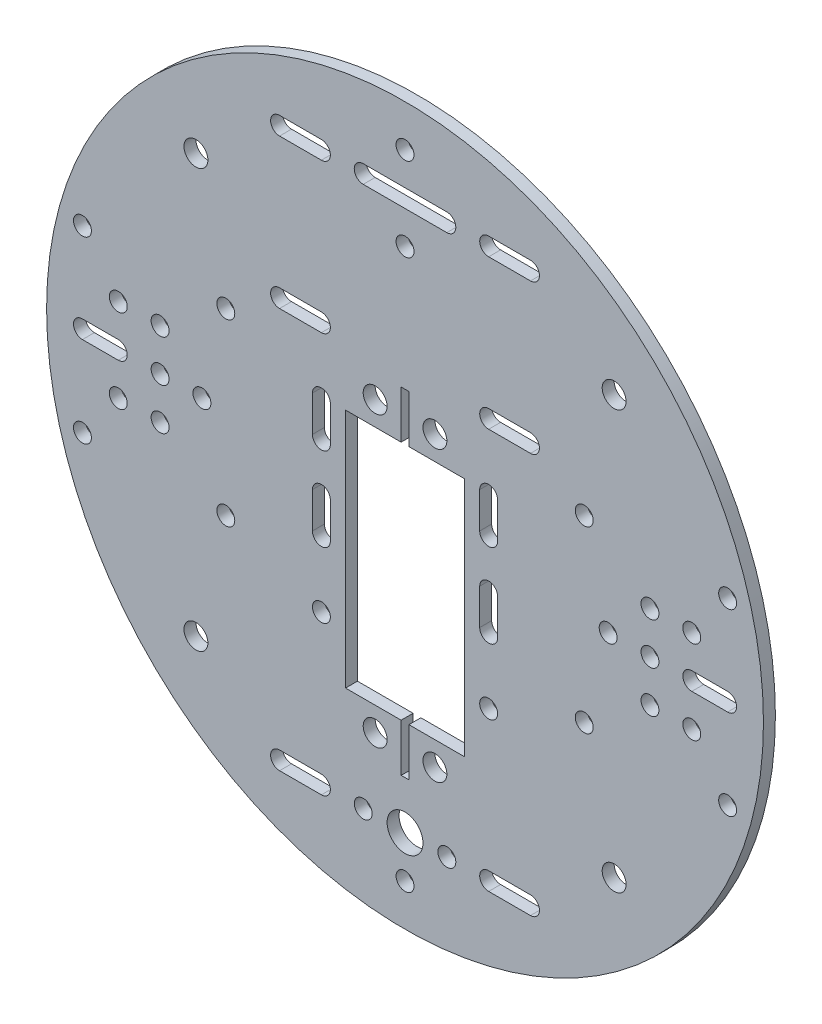
from build123d import *

# Parameters (mm, degrees)
SKETCH_2_R      = 60
SKETCH_2_R_2    = 2
SKETCH_2_R_3    = 1.5
SKETCH_2_R_4    = 3
EXTRUDE_1_DEPTH = 2


with BuildPart() as part:
    # 草图2 → 凸台-拉伸1 (new body)
    with BuildSketch(Plane.XY):
        with Locations((1.687240704, 17.758147453)):
            Circle(SKETCH_2_R)
        with Locations((-3.312759296, 32.050802338)):
            Circle(SKETCH_2_R_2, mode=Mode.SUBTRACT)
        with Locations((6.687240704, -16.249197662)):
            Circle(SKETCH_2_R_2, mode=Mode.SUBTRACT)
        with Locations((-3.312759296, -16.249197662)):
            Circle(SKETCH_2_R_2, mode=Mode.SUBTRACT)
        with Locations((-28.312759296, 32.758147453)):
            Circle(SKETCH_2_R_3, mode=Mode.SUBTRACT)
        with Locations((-52.312759296, 32.758147453)):
            Circle(SKETCH_2_R_3, mode=Mode.SUBTRACT)
        with Locations((-28.312759296, 2.758147453)):
            Circle(SKETCH_2_R_3, mode=Mode.SUBTRACT)
        with Locations((-52.312759296, 2.758147453)):
            Circle(SKETCH_2_R_3, mode=Mode.SUBTRACT)
        with Locations((31.687240704, 32.758147453)):
            Circle(SKETCH_2_R_3, mode=Mode.SUBTRACT)
        with Locations((55.687240704, 32.758147453)):
            Circle(SKETCH_2_R_3, mode=Mode.SUBTRACT)
        with Locations((31.687240704, 2.758147453)):
            Circle(SKETCH_2_R_3, mode=Mode.SUBTRACT)
        with Locations((55.687240704, 2.758147453)):
            Circle(SKETCH_2_R_3, mode=Mode.SUBTRACT)
        with Locations((36.689026372, -17.243638216)):
            Circle(SKETCH_2_R_2, mode=Mode.SUBTRACT)
        with Locations((-33.314544965, -17.243638216)):
            Circle(SKETCH_2_R_2, mode=Mode.SUBTRACT)
        with Locations((-33.314544965, 52.759933122)):
            Circle(SKETCH_2_R_2, mode=Mode.SUBTRACT)
        with Locations((36.689026372, 52.759933122)):
            Circle(SKETCH_2_R_2, mode=Mode.SUBTRACT)
        with Locations((-12.312759296, -3.241852547)):
            Circle(SKETCH_2_R_3, mode=Mode.SUBTRACT)
        with Locations((15.687240704, -3.241852547)):
            Circle(SKETCH_2_R_3, mode=Mode.SUBTRACT)
        with Locations((42.687240704, 24.758147453)):
            Circle(SKETCH_2_R_3, mode=Mode.SUBTRACT)
        with Locations((42.687240704, 10.758147453)):
            Circle(SKETCH_2_R_3, mode=Mode.SUBTRACT)
        with Locations((35.687240704, 17.758147453)):
            Circle(SKETCH_2_R_3, mode=Mode.SUBTRACT)
        with Locations((-39.312759296, 24.758147453)):
            Circle(SKETCH_2_R_3, mode=Mode.SUBTRACT)
        with Locations((-39.312759296, 10.758147453)):
            Circle(SKETCH_2_R_3, mode=Mode.SUBTRACT)
        with Locations((-32.312759296, 17.758147453)):
            Circle(SKETCH_2_R_3, mode=Mode.SUBTRACT)
        with Locations((1.687240704, -35.241852547)):
            Circle(SKETCH_2_R_3, mode=Mode.SUBTRACT)
        with Locations((6.687240704, 32.050802338)):
            Circle(SKETCH_2_R_2, mode=Mode.SUBTRACT)
        with Locations((1.687240704, -28.241852547)):
            Circle(SKETCH_2_R_4, mode=Mode.SUBTRACT)
        with Locations((8.687240704, -28.241852547)):
            Circle(SKETCH_2_R_3, mode=Mode.SUBTRACT)
        with Locations((-5.312759296, -28.241852547)):
            Circle(SKETCH_2_R_3, mode=Mode.SUBTRACT)
        with Locations((49.687240704, 10.758147453)):
            Circle(SKETCH_2_R_3, mode=Mode.SUBTRACT)
        with Locations((42.687240704, 17.758147453)):
            Circle(SKETCH_2_R_3, mode=Mode.SUBTRACT)
        with Locations((49.687240704, 24.758147453)):
            Circle(SKETCH_2_R_3, mode=Mode.SUBTRACT)
        with Locations((-39.312759296, 17.758147453)):
            Circle(SKETCH_2_R_3, mode=Mode.SUBTRACT)
        with Locations((-46.312759296, 10.758147453)):
            Circle(SKETCH_2_R_3, mode=Mode.SUBTRACT)
        with Locations((-46.312759296, 24.758147453)):
            Circle(SKETCH_2_R_3, mode=Mode.SUBTRACT)
        with Locations((1.687240704, 70.758147453)):
            Circle(SKETCH_2_R_3, mode=Mode.SUBTRACT)
        with Locations((1.687240704, 56.758147453)):
            Circle(SKETCH_2_R_3, mode=Mode.SUBTRACT)
        Polygon((1.037240704, -12.244197662), (1.037240704, -20.244197662), (2.337240704, -20.244197662), (2.337240704, -12.244197662), (11.646691261, -12.244197662), (11.646691261, 28.055802338), (2.337240704, 28.055802338), (2.337240704, 36.055802338), (1.037240704, 36.055802338), (1.037240704, 28.055802338), (-8.272209854, 28.055802338), (-8.272209854, -12.244197662), align=None, mode=Mode.SUBTRACT)
        with BuildLine():
            Line((14.187240704, 13.758147453), (14.187240704, 7.758147453))
            ThreePointArc((14.187240704, 7.758147453), (15.687240704, 6.258147453), (17.187240704, 7.758147453))
            Line((17.187240704, 7.758147453), (17.187240704, 13.758147453))
            ThreePointArc((17.187240704, 13.758147453), (15.687240704, 15.258147453), (14.187240704, 13.758147453))
        make_face(mode=Mode.SUBTRACT)
        with BuildLine():
            Line((-10.812759296, 7.758147453), (-10.812759296, 13.758147453))
            ThreePointArc((-10.812759296, 13.758147453), (-12.312759296, 15.258147453), (-13.812759296, 13.758147453))
            Line((-13.812759296, 13.758147453), (-13.812759296, 7.758147453))
            ThreePointArc((-13.812759296, 7.758147453), (-12.312759296, 6.258147453), (-10.812759296, 7.758147453))
        make_face(mode=Mode.SUBTRACT)
        with BuildLine():
            Line((-10.812759296, 21.758147453), (-10.812759296, 27.758147453))
            ThreePointArc((-10.812759296, 27.758147453), (-12.312759296, 29.258147453), (-13.812759296, 27.758147453))
            Line((-13.812759296, 27.758147453), (-13.812759296, 21.758147453))
            ThreePointArc((-13.812759296, 21.758147453), (-12.312759296, 20.258147453), (-10.812759296, 21.758147453))
        make_face(mode=Mode.SUBTRACT)
        with BuildLine():
            Line((17.187240704, 21.758147453), (17.187240704, 27.758147453))
            ThreePointArc((17.187240704, 27.758147453), (15.687240704, 29.258147453), (14.187240704, 27.758147453))
            Line((14.187240704, 27.758147453), (14.187240704, 21.758147453))
            ThreePointArc((14.187240704, 21.758147453), (15.687240704, 20.258147453), (17.187240704, 21.758147453))
        make_face(mode=Mode.SUBTRACT)
        with BuildLine():
            Line((15.687240704, -29.741852547), (22.687240704, -29.741852547))
            ThreePointArc((22.687240704, -29.741852547), (24.187240704, -28.241852547), (22.687240704, -26.741852547))
            Line((22.687240704, -26.741852547), (15.687240704, -26.741852547))
            ThreePointArc((15.687240704, -26.741852547), (14.187240704, -28.241852547), (15.687240704, -29.741852547))
        make_face(mode=Mode.SUBTRACT)
        with BuildLine():
            Line((-19.312759296, -29.741852547), (-12.312759296, -29.741852547))
            ThreePointArc((-12.312759296, -29.741852547), (-10.812759296, -28.241852547), (-12.312759296, -26.741852547))
            Line((-12.312759296, -26.741852547), (-19.312759296, -26.741852547))
            ThreePointArc((-19.312759296, -26.741852547), (-20.812759296, -28.241852547), (-19.312759296, -29.741852547))
        make_face(mode=Mode.SUBTRACT)
        with BuildLine():
            Line((-19.312759296, 62.258147453), (-12.312759296, 62.258147453))
            ThreePointArc((-12.312759296, 62.258147453), (-10.812759296, 63.758147453), (-12.312759296, 65.258147453))
            Line((-12.312759296, 65.258147453), (-19.312759296, 65.258147453))
            ThreePointArc((-19.312759296, 65.258147453), (-20.812759296, 63.758147453), (-19.312759296, 62.258147453))
        make_face(mode=Mode.SUBTRACT)
        with BuildLine():
            Line((15.687240704, 62.258147453), (22.687240704, 62.258147453))
            ThreePointArc((22.687240704, 62.258147453), (24.187240704, 63.758147453), (22.687240704, 65.258147453))
            Line((22.687240704, 65.258147453), (15.687240704, 65.258147453))
            ThreePointArc((15.687240704, 65.258147453), (14.187240704, 63.758147453), (15.687240704, 62.258147453))
        make_face(mode=Mode.SUBTRACT)
        with BuildLine():
            Line((-19.312759296, 37.258147453), (-12.312759296, 37.258147453))
            ThreePointArc((-12.312759296, 37.258147453), (-10.812759296, 38.758147453), (-12.312759296, 40.258147453))
            Line((-12.312759296, 40.258147453), (-19.312759296, 40.258147453))
            ThreePointArc((-19.312759296, 40.258147453), (-20.812759296, 38.758147453), (-19.312759296, 37.258147453))
        make_face(mode=Mode.SUBTRACT)
        with BuildLine():
            Line((15.687240704, 37.258147453), (22.687240704, 37.258147453))
            ThreePointArc((22.687240704, 37.258147453), (24.187240704, 38.758147453), (22.687240704, 40.258147453))
            Line((22.687240704, 40.258147453), (15.687240704, 40.258147453))
            ThreePointArc((15.687240704, 40.258147453), (14.187240704, 38.758147453), (15.687240704, 37.258147453))
        make_face(mode=Mode.SUBTRACT)
        with BuildLine():
            Line((49.687240704, 16.258147453), (55.687240704, 16.258147453))
            ThreePointArc((55.687240704, 16.258147453), (57.187240704, 17.758147453), (55.687240704, 19.258147453))
            Line((55.687240704, 19.258147453), (49.687240704, 19.258147453))
            ThreePointArc((49.687240704, 19.258147453), (48.187240704, 17.758147453), (49.687240704, 16.258147453))
        make_face(mode=Mode.SUBTRACT)
        with BuildLine():
            Line((-52.312759296, 16.258147453), (-46.312759296, 16.258147453))
            ThreePointArc((-46.312759296, 16.258147453), (-44.812759296, 17.758147453), (-46.312759296, 19.258147453))
            Line((-46.312759296, 19.258147453), (-52.312759296, 19.258147453))
            ThreePointArc((-52.312759296, 19.258147453), (-53.812759296, 17.758147453), (-52.312759296, 16.258147453))
        make_face(mode=Mode.SUBTRACT)
        with BuildLine():
            Line((-5.312759296, 62.258147453), (8.687240704, 62.258147453))
            ThreePointArc((8.687240704, 62.258147453), (10.187240704, 63.758147453), (8.687240704, 65.258147453))
            Line((8.687240704, 65.258147453), (-5.312759296, 65.258147453))
            ThreePointArc((-5.312759296, 65.258147453), (-6.812759296, 63.758147453), (-5.312759296, 62.258147453))
        make_face(mode=Mode.SUBTRACT)
    extrude(amount=EXTRUDE_1_DEPTH)


solid = part.part
